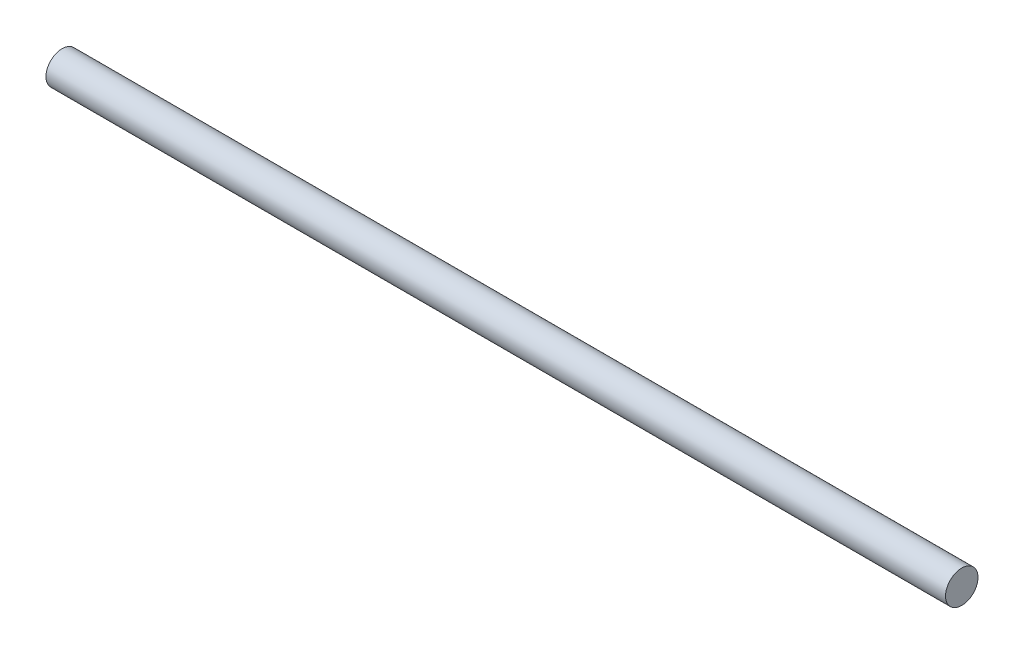
from build123d import *

# Parameters (mm, degrees)
SKETCH1_R           = 21.082
BOSS_EXTRUDE1_DEPTH = 1168.4


with BuildPart() as part:
    # Sketch1 → Boss-Extrude1 (new body)
    with BuildSketch(Plane(origin=(0, 0, 0), x_dir=(0, 0, -1), z_dir=(1, 0, 0))):
        Circle(SKETCH1_R)
    extrude(amount=BOSS_EXTRUDE1_DEPTH)


solid = part.part
